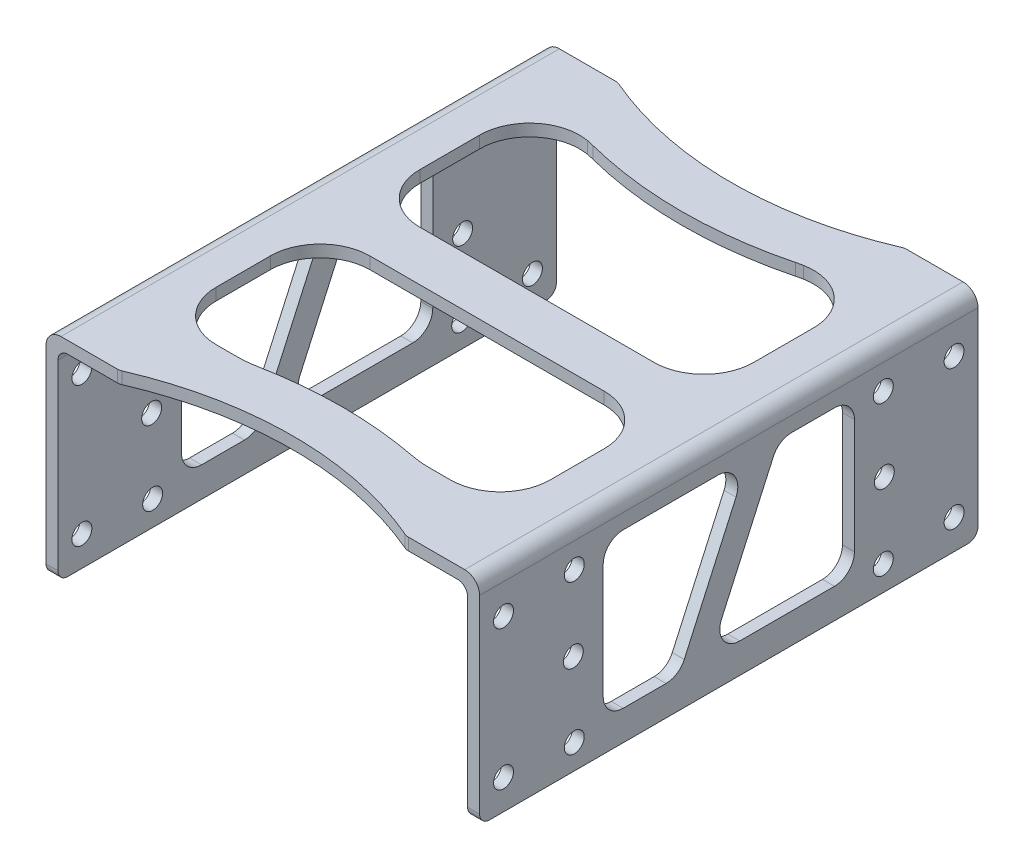
from build123d import *

# Parameters (mm, degrees)
SKETCH_1_W                = 43.5
SKETCH_1_H                = 50
EXTRUDE_1_DEPTH           = 21.5
SKETCH_2_W                = 41.1
SKETCH_2_H                = 22.668209098
CUT_EXTRUDE_1_DEPTH       = 59.078072454
CUT_EXTRUDE_2_DEPTH       = 44.546670366
CUT_EXTRUDE_3_DEPTH       = 44.546670366
HOLE_WIZARD_2_0_2_1_D     = 2
HOLE_WIZARD_2_0_2_1_DEPTH = 1.2
HOLE_WIZARD_2_0_2_2_D     = 2
FILLET_1_R                = 1
FILLET_2_R                = 1.5
FILLET_3_R                = 1
CUT_EXTRUDE_5_DEPTH       = 10
FILLET_4_R                = 10
FILLET_5_R                = 5
CUT_EXTRUDE_6_DEPTH       = 58.037268572
FILLET_6_R                = 2
FILLET_7_R                = 2


with BuildPart() as part:
    # 草图1 → 凸台-拉伸1 (new body)
    with BuildSketch(Plane.XZ.offset(20)):
        with Locations((0, -6)):
            Rectangle(SKETCH_1_W, SKETCH_1_H)
    extrude(amount=-EXTRUDE_1_DEPTH)

    # 草图2 → 切除-拉伸1 (cut, through all)
    with BuildSketch(Plane.XY.offset(19)):
        with Locations((0, -11.034104549)):
            Rectangle(SKETCH_2_W, SKETCH_2_H)
    extrude(amount=-CUT_EXTRUDE_1_DEPTH, mode=Mode.SUBTRACT)

    # 草图3 → 切除-拉伸2 (cut, through all)
    with BuildSketch(Plane(origin=(0, 1.5, 0), x_dir=(-1, 0, 0), z_dir=(0, 1, 0))):
        with BuildLine():
            Line((14.38749457, 19), (-14.38749457, 19))
            ThreePointArc((-14.38749457, 19), (0, 16), (14.38749457, 19))
        make_face()
    extrude(amount=-CUT_EXTRUDE_2_DEPTH, mode=Mode.SUBTRACT)

    # 草图4 → 切除-拉伸3 (cut, through all)
    with BuildSketch(Plane(origin=(0, 1.5, 0), x_dir=(-1, 0, 0), z_dir=(0, 1, 0))):
        with BuildLine():
            Line((-14.38749457, -31), (14.38749457, -31))
            ThreePointArc((14.38749457, -31), (0, -28), (-14.38749457, -31))
        make_face()
    extrude(amount=-CUT_EXTRUDE_3_DEPTH, mode=Mode.SUBTRACT)

    # Ø2.0 (2) 直径孔1
    with Locations(Plane.ZY.offset(-20.55)):
        with Locations((16.6, -3), (16.6, -17), (9.5, -17.5), (9.6, -10), (9.5, -2.5), (-21.5, -2.5), (-28.6, -3), (-28.6, -17), (-21.5, -17.5), (-21.6, -10)):
            Hole(HOLE_WIZARD_2_0_2_1_D / 2, depth=HOLE_WIZARD_2_0_2_1_DEPTH)

    # Ø2.0 (2) 直径孔2 (through all)
    with Locations(Plane(origin=(-20.55, 0, 0), x_dir=(0, 0, -1), z_dir=(1, 0, 0))):
        with Locations((-16.6, -3), (-16.6, -17), (-9.5, -17.5), (-9.6, -10), (-9.5, -2.5), (21.5, -2.5), (28.6, -3), (28.6, -17), (21.5, -17.5), (21.6, -10)):
            Hole(HOLE_WIZARD_2_0_2_2_D / 2)

    # 圆角1
    fillet_1_edges = [part.edges().sort_by_distance(p)[0] for p in [
        (-21.15, -20, 19),
        (21.15, -20, -31),
        (-14.38749457, 0.9, 19),
        (14.38749457, 0.9, 19),
        (-21.15, -20, -31),
        (14.38749457, 0.9, -31),
        (-14.38749457, 0.9, -31),
        (21.15, -20, 19),
    ]]
    fillet(fillet_1_edges, radius=FILLET_1_R)

    # 圆角2
    fillet_2_edges = [part.edges().sort_by_distance(p)[0] for p in [
        (-21.75, 1.5, -6),
        (21.75, 1.5, -6),
    ]]
    fillet(fillet_2_edges, radius=FILLET_2_R)

    # 圆角3
    fillet_3_edges = [part.edges().sort_by_distance(p)[0] for p in [
        (-20.55, 0.3, -6),
        (20.55, 0.3, -6),
    ]]
    fillet(fillet_3_edges, radius=FILLET_3_R)

    # 草图14 → 切除-拉伸5 (cut)
    with BuildSketch(Plane(origin=(0, 1.5, 0), x_dir=(1, 0, 0), z_dir=(0, 1, 0))):
        with BuildLine():
            Line((-11.33348239, 24.597561282), (-16.75, 24.597561282))
            Line((-16.75, 24.597561282), (-16.75, 8.5))
            Line((-16.75, 8.5), (16.75, 8.5))
            Line((16.75, 8.5), (16.75, 24.597561282))
            Line((16.75, 24.597561282), (11.33348239, 24.597561282))
            ThreePointArc((11.33348239, 24.597561282), (0, 23), (-11.33348239, 24.597561282))
        make_face()
        with BuildLine():
            Line((16.75, 3.5), (-16.75, 3.5))
            Line((-16.75, 3.5), (-16.75, -11.921871339))
            Line((-16.75, -11.921871339), (-8.645438281, -11.921871339))
            ThreePointArc((-8.645438281, -11.921871339), (0, -11), (8.645438281, -11.921871339))
            Line((8.645438281, -11.921871339), (16.75, -11.921871339))
            Line((16.75, -11.921871339), (16.75, 3.5))
        make_face()
    extrude(amount=-CUT_EXTRUDE_5_DEPTH, mode=Mode.SUBTRACT)

    # 圆角4
    fillet_4_edges = [part.edges().sort_by_distance(p)[0] for p in [
        (-11.33348239, 0.9, -24.597561282),
        (11.33348239, 0.9, -24.597561282),
        (8.645438281, 0.9, 11.921871339),
        (-8.645438281, 0.9, 11.921871339),
    ]]
    fillet(fillet_4_edges, radius=FILLET_4_R)

    # 圆角5
    fillet_5_edges = [part.edges().sort_by_distance(p)[0] for p in [
        (-16.75, 0.9, 11.921871339),
        (-16.75, 0.9, -3.5),
        (16.75, 0.9, 11.921871339),
        (16.75, 0.9, -3.5),
        (16.75, 0.9, -8.5),
        (16.75, 0.9, -24.597561282),
        (-16.75, 0.9, -8.5),
        (-16.75, 0.9, -24.597561282),
    ]]
    fillet(fillet_5_edges, radius=FILLET_5_R)

    # 草图15 → 切除-拉伸6 (cut, through all)
    with BuildSketch(Plane.ZY.offset(21.75)):
        Polygon((-11, -1.5), (-18.6, -1.5), (-18.6, -17), (-6, -17), (-6, -12.571428571), align=None)
        Polygon((-4, -17), (-6, -12.571428571), (-6, -17), align=None)
        Polygon((6.6, -1.5), (-6, -1.5), (-6, -5.928571429), (-1, -17), (6.6, -17), align=None)
        Polygon((-6, -1.5), (-8, -1.5), (-6, -5.928571429), align=None)
    extrude(amount=-CUT_EXTRUDE_6_DEPTH, mode=Mode.SUBTRACT)

    # 圆角6
    fillet_6_edges = [part.edges().sort_by_distance(p)[0] for p in [
        (-21.15, -1.5, -8),
        (-21.15, -1.5, 6.6),
        (-21.15, -17, 6.6),
        (-21.15, -17, -1),
        (-21.15, -17, -4),
        (-21.15, -17, -18.6),
        (-21.15, -1.5, -18.6),
        (-21.15, -1.5, -11),
    ]]
    fillet(fillet_6_edges, radius=FILLET_6_R)

    # 圆角7
    fillet_7_edges = [part.edges().sort_by_distance(p)[0] for p in [
        (21.15, -1.5, -8),
        (21.15, -1.5, 6.6),
        (21.15, -17, 6.6),
        (21.15, -17, -1),
        (21.15, -17, -4),
        (21.15, -17, -18.6),
        (21.15, -1.5, -18.6),
        (21.15, -1.5, -11),
    ]]
    fillet(fillet_7_edges, radius=FILLET_7_R)


solid = part.part
